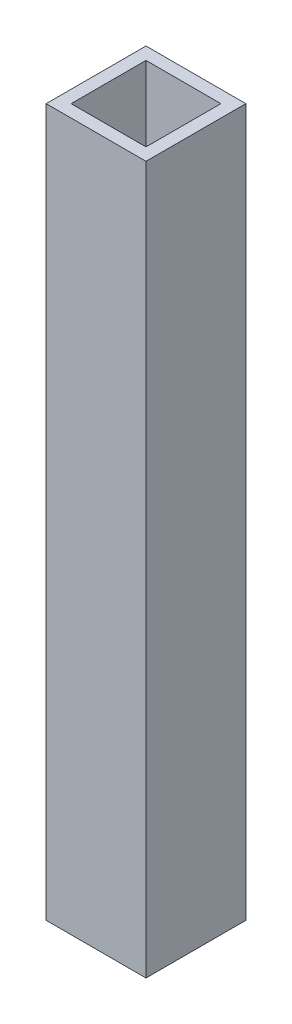
from build123d import *

# Parameters (mm, degrees)
CROQUIS1_W            = 24
CROQUIS1_H            = 24
CROQUIS1_W_2          = 18
CROQUIS1_H_2          = 18
EXTRUIR_L_MINA1_DEPTH = 170


with BuildPart() as part:
    # Croquis1 → Extruir-Lámina1 (new body)
    with BuildSketch(Plane(origin=(0, 0, 0), x_dir=(1, 0, 0), z_dir=(0, 1, 0))):
        Rectangle(CROQUIS1_W, CROQUIS1_H)
        Rectangle(CROQUIS1_W_2, CROQUIS1_H_2, mode=Mode.SUBTRACT)
    extrude(amount=EXTRUIR_L_MINA1_DEPTH)


solid = part.part
